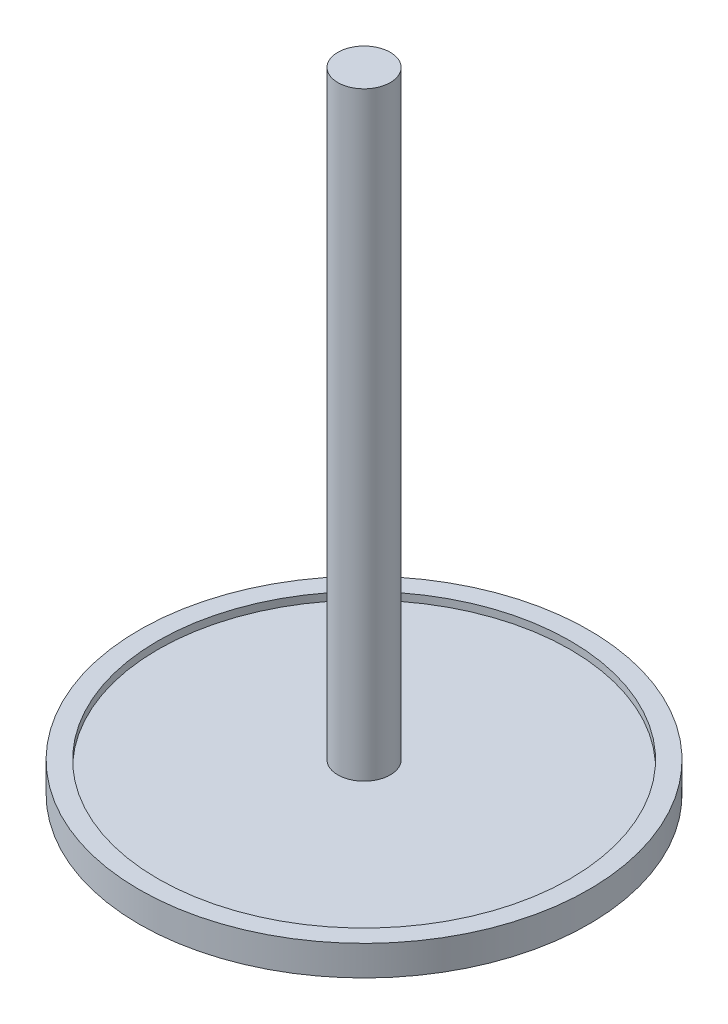
from build123d import *

# Parameters (mm, degrees)
SKETCH1_R           = 150
BOSS_EXTRUDE1_DEPTH = 20
SKETCH2_R           = 17.5
BOSS_EXTRUDE2_DEPTH = 400
SKETCH4_R           = 137.5
CUT_EXTRUDE1_DEPTH  = 5


with BuildPart() as part:
    # Sketch1 → Boss-Extrude1 (new body)
    with BuildSketch(Plane(origin=(0, 0, 0), x_dir=(1, 0, 0), z_dir=(0, 1, 0))):
        with Locations(Location((0, 0, 0), (0, 0, 270))):
            Circle(SKETCH1_R)
    extrude(amount=BOSS_EXTRUDE1_DEPTH)

    # Sketch2 → Boss-Extrude2 (add)
    with BuildSketch(Plane(origin=(0, 20, 0), x_dir=(1, 0, 0), z_dir=(0, 1, 0))):
        with Locations(Location((0, 0, 0), (0, 0, 270))):
            Circle(SKETCH2_R)
    extrude(amount=BOSS_EXTRUDE2_DEPTH)

    # Sketch4 → Cut-Extrude1 (cut)
    with BuildSketch(Plane(origin=(0, 20, 0), x_dir=(1, 0, 0), z_dir=(0, 1, 0))):
        with Locations(Location((0, 0, 0), (0, 0, 270))):
            Circle(SKETCH4_R)
    extrude(amount=-CUT_EXTRUDE1_DEPTH, mode=Mode.SUBTRACT)


with BuildPart() as cut_extrude1_piece_1:
    # of the separate pieces the step leaves, piece 1, a body of its own (cut_extrude1_pieces)
    add(part.part.solids().sort_by_distance((0, 0, 150))[0])


with BuildPart() as cut_extrude1_piece_2:
    # of the separate pieces the step leaves, piece 2, a body of its own (cut_extrude1_pieces)
    add(part.part.solids().sort_by_distance((0, 20, 17.5))[0])


solid = Compound([cut_extrude1_piece_1.part, cut_extrude1_piece_2.part])
